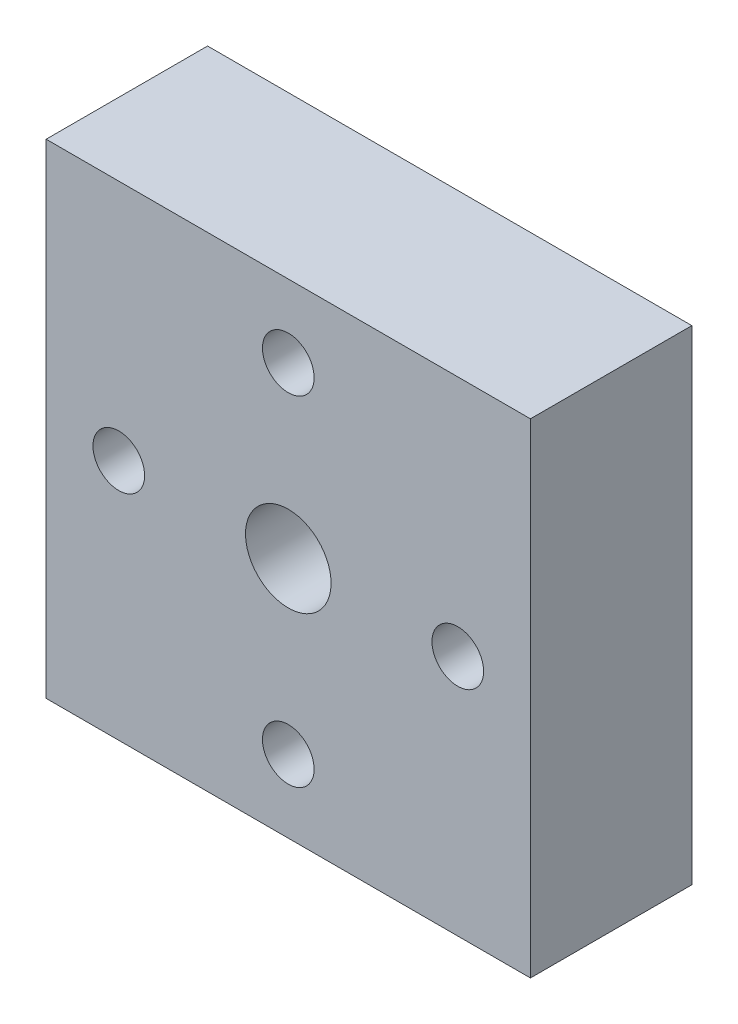
from build123d import *

# Parameters (mm, degrees)
SKETCH1_W           = 30
SKETCH1_H           = 30
BOSS_EXTRUDE1_DEPTH = 30
SKETCH2_R           = 0.65
CUT_EXTRUDE1_DEPTH  = 7
SKETCH3_R           = 1.95
BOSS_EXTRUDE2_DEPTH = 2
SKETCH4_R           = 3.2
SKETCH4_R_2         = 2.5
CUT_EXTRUDE2_DEPTH  = 1
SKETCH5_R           = 2.65
CUT_EXTRUDE3_DEPTH  = 46
SKETCH6_W           = 20
SKETCH6_H           = 32.666349305
CUT_EXTRUDE4_DEPTH  = 38.603191354
SKETCH7_R           = 3
CUT_EXTRUDE5_DEPTH  = 5
SKETCH8_R           = 1.6
CUT_EXTRUDE6_DEPTH  = 35.263683398


with BuildPart() as part:
    # Sketch1 → Boss-Extrude1 (new body)
    with BuildSketch(Plane(origin=(0, 0, 0), x_dir=(0, 0, -1), z_dir=(1, 0, 0))):
        Rectangle(SKETCH1_W, SKETCH1_H)
    extrude(amount=BOSS_EXTRUDE1_DEPTH)

    # Sketch2 → Cut-Extrude1 (cut)
    with BuildSketch(Plane(origin=(0, 0, -15), x_dir=(-1, 0, 0), z_dir=(0, 0, -1))):
        with Locations(Location((-15, 6.000101914, 0), (0, 0, 90))):
            Circle(SKETCH2_R)
        with Locations(Location((-21.001003121, 0.002997762, 0), (0, 0, 90))):
            Circle(SKETCH2_R)
        with Locations(Location((-8.997324254, 0.002997762, 0), (0, 0, 90))):
            Circle(SKETCH2_R)
        with Locations(Location((-15, -6.000101914, 0), (0, 0, 90))):
            Circle(SKETCH2_R)
    extrude(amount=-CUT_EXTRUDE1_DEPTH, mode=Mode.SUBTRACT)

    # Sketch3 → Boss-Extrude2 (add)
    with BuildSketch(Plane(origin=(0, 0, -15), x_dir=(-1, 0, 0), z_dir=(0, 0, -1))):
        with Locations(Location((-6.16, 8.84, 0), (0, 0, 270))):
            Circle(SKETCH3_R)
        with Locations(Location((-23.84, 8.84, 0), (0, 0, 270))):
            Circle(SKETCH3_R)
        with Locations(Location((-23.84, -8.84, 0), (0, 0, 270))):
            Circle(SKETCH3_R)
        with Locations(Location((-6.16, -8.84, 0), (0, 0, 270))):
            Circle(SKETCH3_R)
    extrude(amount=BOSS_EXTRUDE2_DEPTH)

    # Sketch4 → Cut-Extrude2 (cut)
    with BuildSketch(Plane(origin=(0, 0, -15), x_dir=(-1, 0, 0), z_dir=(0, 0, -1))):
        with Locations(Location((-15, 0, 0), (0, 0, 90))):
            Circle(SKETCH4_R)
        with Locations(Location((-15, 0, 0), (0, 0, 90))):
            Circle(SKETCH4_R_2, mode=Mode.SUBTRACT)
    extrude(amount=-CUT_EXTRUDE2_DEPTH, mode=Mode.SUBTRACT)

    # Sketch5 → Cut-Extrude3 (cut, through all)
    with BuildSketch(Plane(origin=(0, 0, -15), x_dir=(-1, 0, 0), z_dir=(0, 0, -1))):
        with Locations(Location((-15, 0, 0), (0, 0, 90))):
            Circle(SKETCH5_R)
    extrude(amount=-CUT_EXTRUDE3_DEPTH, mode=Mode.SUBTRACT)

    # Sketch6 → Cut-Extrude4 (cut, through all)
    with BuildSketch(Plane(origin=(30, 0, 0), x_dir=(0, 0, -1), z_dir=(1, 0, 0))):
        with Locations((-5, -1.333174652)):
            Rectangle(SKETCH6_W, SKETCH6_H)
    extrude(amount=-CUT_EXTRUDE4_DEPTH, mode=Mode.SUBTRACT)

    # Sketch7 → Cut-Extrude5 (cut)
    with BuildSketch(Plane(origin=(0, 0, -15), x_dir=(-1, 0, 0), z_dir=(0, 0, -1))):
        with Locations(Location((-15, 10.5, 0), (0, 0, 90))):
            Circle(SKETCH7_R)
        with Locations(Location((-15, -10.5, 0), (0, 0, 90))):
            Circle(SKETCH7_R)
        with Locations(Location((-25.5, 0, 0), (0, 0, 90))):
            Circle(SKETCH7_R)
        with Locations(Location((-4.5, 0, 0), (0, 0, 90))):
            Circle(SKETCH7_R)
    extrude(amount=-CUT_EXTRUDE5_DEPTH, mode=Mode.SUBTRACT)

    # Sketch8 → Cut-Extrude6 (cut, through all)
    with BuildSketch(Plane(origin=(0, 0, -10), x_dir=(-1, 0, 0), z_dir=(0, 0, -1))):
        with Locations(Location((-4.5, 0, 0), (0, 0, 90))):
            Circle(SKETCH8_R)
        with Locations(Location((-15, -10.5, 0), (0, 0, 90))):
            Circle(SKETCH8_R)
        with Locations(Location((-15, 10.5, 0), (0, 0, 90))):
            Circle(SKETCH8_R)
        with Locations(Location((-25.5, 0, 0), (0, 0, 90))):
            Circle(SKETCH8_R)
    extrude(amount=-CUT_EXTRUDE6_DEPTH, mode=Mode.SUBTRACT)


solid = part.part
